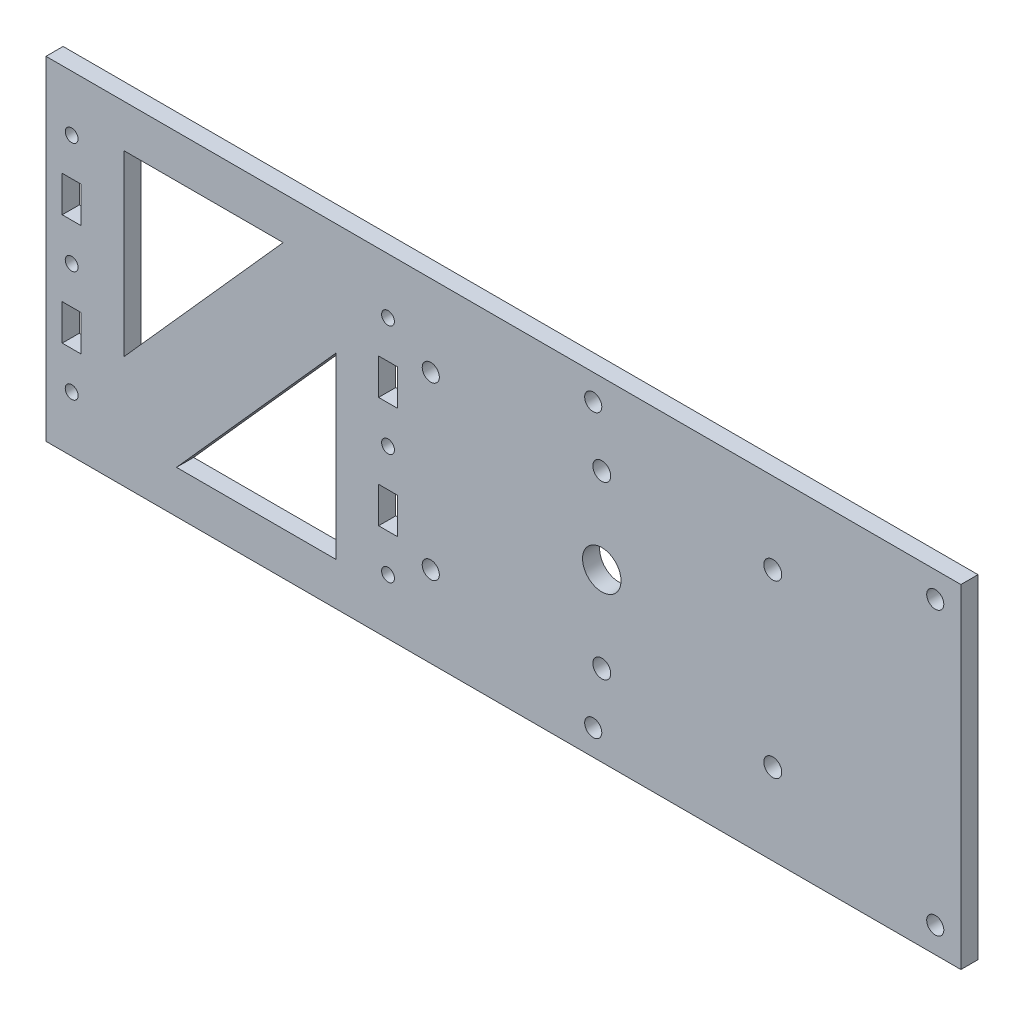
from build123d import *

# Parameters (mm, degrees)
SKETCH_1_R          = 1.5
SKETCH_1_R_2        = 4.5
SKETCH_1_R_3        = 2.096788488
SKETCH_1_R_4        = 2
SKETCH_1_W          = 4.4
SKETCH_1_H          = 8.4
EXTRUDE_1_DEPTH     = 4
SKETCH_2_R          = 2
CUT_EXTRUDE_1_DEPTH = 10


with BuildPart() as part:
    # 草图1 → 凸台-拉伸1 (new body)
    with BuildSketch(Plane.XY):
        Polygon((-6, 39), (134, 39), (134, -39), (-6, -39), (-80, -39), (-80, 39), align=None)
        Circle(SKETCH_1_R, mode=Mode.SUBTRACT)
        with Locations(Location((0, 26, 0), (0, 0, 180))):
            Circle(SKETCH_1_R, mode=Mode.SUBTRACT)
        with Locations((0, -26)):
            Circle(SKETCH_1_R, mode=Mode.SUBTRACT)
        with Locations((50, 0)):
            Circle(SKETCH_1_R_2, mode=Mode.SUBTRACT)
        with Locations((50, 20)):
            Circle(SKETCH_1_R_3, mode=Mode.SUBTRACT)
        with Locations((50, -20)):
            Circle(SKETCH_1_R_3, mode=Mode.SUBTRACT)
        with Locations((90, -20)):
            Circle(SKETCH_1_R_3, mode=Mode.SUBTRACT)
        with Locations((90, 20)):
            Circle(SKETCH_1_R_3, mode=Mode.SUBTRACT)
        with Locations((10, -20)):
            Circle(SKETCH_1_R_4, mode=Mode.SUBTRACT)
        with Locations(Location((10, 20, 0), (0, 0, 180))):
            Circle(SKETCH_1_R_4, mode=Mode.SUBTRACT)
        with Locations(Location((-74, 0, 0), (0, 0, 180))):
            Circle(SKETCH_1_R, mode=Mode.SUBTRACT)
        with Locations((-74, 26)):
            Circle(SKETCH_1_R, mode=Mode.SUBTRACT)
        with Locations(Location((-74, -26, 0), (0, 0, 180))):
            Circle(SKETCH_1_R, mode=Mode.SUBTRACT)
        with Locations((0, 13)):
            Rectangle(SKETCH_1_W, SKETCH_1_H, mode=Mode.SUBTRACT)
        with Locations((0, -13)):
            Rectangle(SKETCH_1_W, SKETCH_1_H, mode=Mode.SUBTRACT)
        with Locations((-74, 13)):
            Rectangle(SKETCH_1_W, SKETCH_1_H, mode=Mode.SUBTRACT)
        with Locations((-74, -13)):
            Rectangle(SKETCH_1_W, SKETCH_1_H, mode=Mode.SUBTRACT)
    extrude(amount=EXTRUDE_1_DEPTH)

    # 草图2 → 切除-拉伸1 (cut)
    with BuildSketch(Plane(origin=(0, 0, 0), x_dir=(-1, 0, 0), z_dir=(0, 0, -1))):
        with Locations((-128, -33)):
            Circle(SKETCH_2_R)
        with Locations((-48, -33)):
            Circle(SKETCH_2_R)
        with Locations((-48, 33)):
            Circle(SKETCH_2_R)
        with Locations((-128, 33)):
            Circle(SKETCH_2_R)
        Polygon((61.8, -12.773298845), (24.525364108, 29), (61.8, 29), align=None)
        Polygon((12.2, -29), (49.474635892, -29), (12.2, 12.773298845), align=None)
    extrude(amount=-CUT_EXTRUDE_1_DEPTH, mode=Mode.SUBTRACT)


solid = part.part
